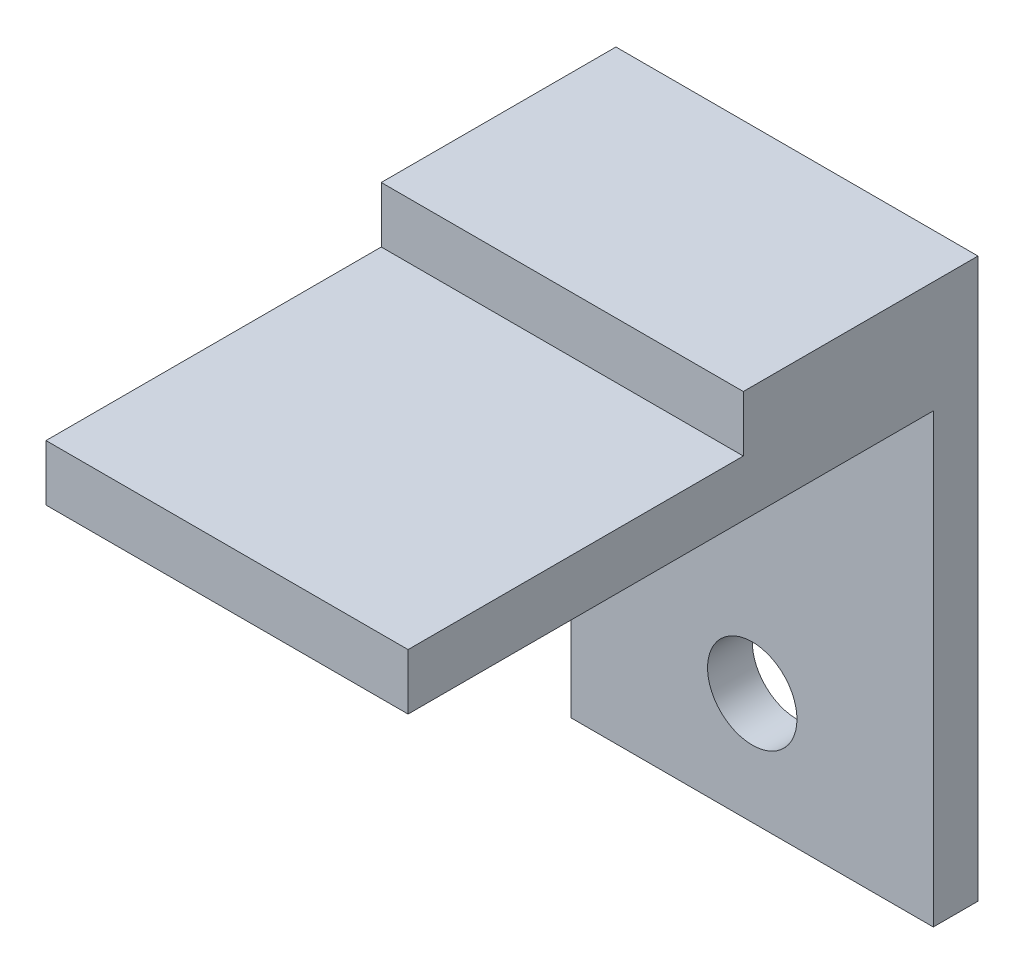
from build123d import *

# Parameters (mm, degrees)
SKETCH1_W            = 16.2
SKETCH1_H            = 16
SKETCH1_R            = 2
BOSS_EXTRUDE3_DEPTH  = 2
SKETCH1_3_W          = 3
SKETCH1_3_H          = 2.5
BOSS_EXTRUDE4_DEPTH  = 25.5
SKETCH1_4_W          = 2
SKETCH1_4_H          = 2
BOSS_EXTRUDE5_DEPTH  = 1.5
SKETCH1_8_W          = 13.2
SKETCH1_8_H          = 2.5
BOSS_EXTRUDE6_DEPTH  = 2
SKETCH1_9_W          = 13.2
SKETCH1_9_H          = 4
SKETCH1_9_W_2        = 3
BOSS_EXTRUDE7_DEPTH  = 2
SKETCH1_11_W         = 3
SKETCH1_11_H         = 2.5
SKETCH1_11_W_2       = 13.2
BOSS_EXTRUDE9_DEPTH  = 10.5
SKETCH1_12_W         = 13.2
SKETCH1_12_H         = 2.5
BOSS_EXTRUDE10_DEPTH = 25.5


with BuildPart() as part:
    # Sketch1 → Boss-Extrude3 (new body)
    with BuildSketch(Plane.XY):
        with Locations((0, -4.5)):
            Rectangle(SKETCH1_W, SKETCH1_H)
        with Locations((0, -7.5)):
            Circle(SKETCH1_R, mode=Mode.SUBTRACT)
    extrude(amount=BOSS_EXTRUDE3_DEPTH)

    # Sketch1<4> → Boss-Extrude5 (add)
    with BuildSketch(Plane.XY):
        with Locations((0, -1.5)):
            Rectangle(SKETCH1_4_W, SKETCH1_4_H)
    extrude(amount=-BOSS_EXTRUDE5_DEPTH)



with BuildPart() as body_2:
    # Sketch1<3> → Boss-Extrude4 (new body)
    with BuildSketch(Plane.XY):
        with Locations((-6.6, 8.75)):
            Rectangle(SKETCH1_3_W, SKETCH1_3_H)
    extrude(amount=BOSS_EXTRUDE4_DEPTH)


with BuildPart() as body_3:
    # Sketch1<8> → Boss-Extrude6 (new body)
    with BuildSketch(Plane.XY):
        with Locations((1.5, 8.75)):
            Rectangle(SKETCH1_8_W, SKETCH1_8_H)
    extrude(amount=BOSS_EXTRUDE6_DEPTH)


with BuildPart() as part_1:
    add(part.part)

    add(body_2.part)  # Boss-Extrude7 merges body 2

    add(body_3.part)  # Boss-Extrude7 merges body 3
    # Sketch1<9> → Boss-Extrude7 (add)
    with BuildSketch(Plane.XY):
        with Locations((1.5, 5.5)):
            Rectangle(SKETCH1_9_W, SKETCH1_9_H)
        with Locations((-6.6, 5.5)):
            Rectangle(SKETCH1_9_W_2, SKETCH1_9_H)
    extrude(amount=BOSS_EXTRUDE7_DEPTH)

    # Sketch1<11> → Boss-Extrude9 (add)
    with BuildSketch(Plane.XY):
        with Locations((-6.6, 11.25)):
            Rectangle(SKETCH1_11_W, SKETCH1_11_H)
        with Locations((1.5, 11.25)):
            Rectangle(SKETCH1_11_W_2, SKETCH1_11_H)
    extrude(amount=BOSS_EXTRUDE9_DEPTH)

    # Sketch1<12> → Boss-Extrude10 (add)
    with BuildSketch(Plane.XY):
        with Locations((1.5, 8.75)):
            Rectangle(SKETCH1_12_W, SKETCH1_12_H)
    extrude(amount=BOSS_EXTRUDE10_DEPTH)


solid = part_1.part
